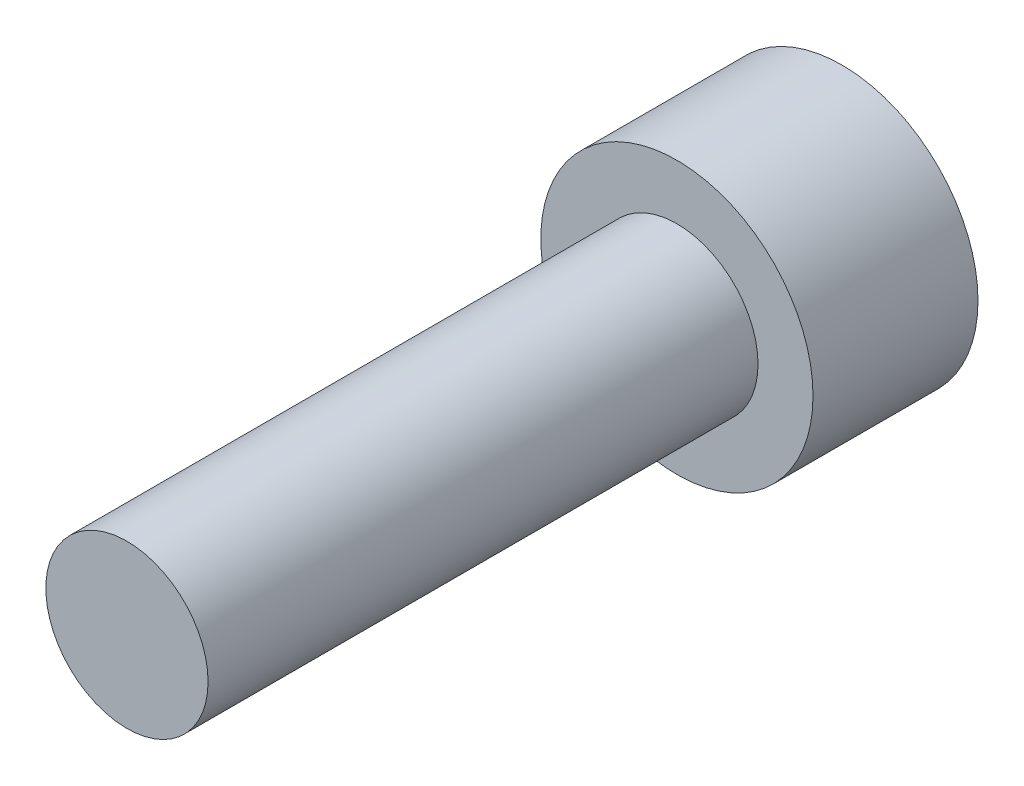
from build123d import *

# Parameters (mm, degrees)
SKIZZE1_R                       = 4.95
AUFSATZ_LINEAR_AUSTRAGEN1_DEPTH = 6
SKIZZE2_R                       = 2.95
AUFSATZ_LINEAR_AUSTRAGEN2_DEPTH = 20


with BuildPart() as part:
    # Skizze1 → Aufsatz-Linear austragen1 (new body)
    with BuildSketch(Plane.XY):
        Circle(SKIZZE1_R)
    extrude(amount=AUFSATZ_LINEAR_AUSTRAGEN1_DEPTH)

    # Skizze2 → Aufsatz-Linear austragen2 (add)
    with BuildSketch(Plane.XY.offset(6)):
        Circle(SKIZZE2_R)
    extrude(amount=AUFSATZ_LINEAR_AUSTRAGEN2_DEPTH)


solid = part.part
